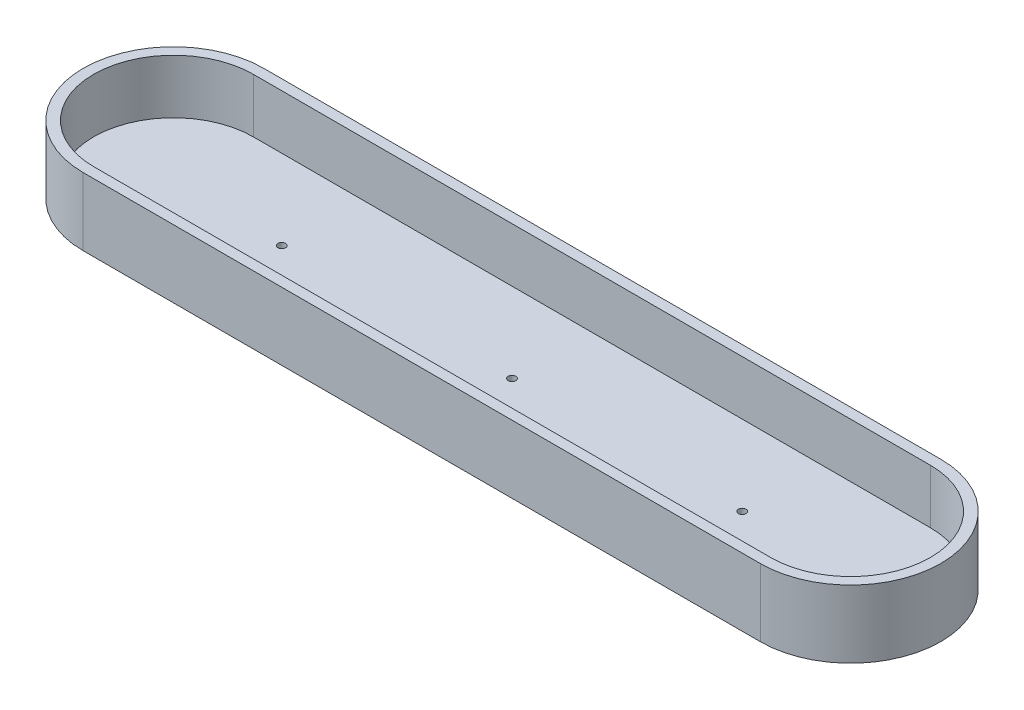
from build123d import *

# Parameters (mm, degrees)
MAINBLOCK_DEPTH     = 3.81
BOSS_EXTRUDE1_DEPTH = 19.05
SKETCH3_R           = 1.0795
CUT_EXTRUDE1_DEPTH  = 125.757705173


with BuildPart() as part:
    # Sketch1 → MainBlock (new body)
    with BuildSketch(Plane(origin=(0, 0, 0), x_dir=(1, 0, 0), z_dir=(0, 1, 0))):
        with BuildLine():
            Line((-95.25, 22.479), (95.25, 22.479))
            ThreePointArc((95.25, 22.479), (117.729, 0), (95.25, -22.479))
            Line((95.25, -22.479), (-95.25, -22.479))
            ThreePointArc((-95.25, -22.479), (-117.729, 0), (-95.25, 22.479))
        make_face()
    extrude(amount=MAINBLOCK_DEPTH)

    # Sketch2 → Boss-Extrude1 (add)
    with BuildSketch(Plane.XZ):
        with BuildLine():
            Line((-95.25, 25.4), (95.25, 25.4))
            ThreePointArc((95.25, 25.4), (120.65, 0), (95.25, -25.4))
            Line((95.25, -25.4), (-95.25, -25.4))
            ThreePointArc((-95.25, -25.4), (-120.65, 0), (-95.25, 25.4))
        make_face()
        with BuildLine():
            Line((95.25, 22.479), (-95.25, 22.479))
            ThreePointArc((-95.25, 22.479), (-117.729, 0), (-95.25, -22.479))
            Line((-95.25, -22.479), (95.25, -22.479))
            ThreePointArc((95.25, -22.479), (117.729, 0), (95.25, 22.479))
        make_face(mode=Mode.SUBTRACT)
    extrude(amount=-BOSS_EXTRUDE1_DEPTH)

    # Sketch3 → Cut-Extrude1 (cut, through all)
    with BuildSketch(Plane.XZ):
        with Locations(Location((0, 0, 0), (0, 0, 270))):
            Circle(SKETCH3_R)
        with Locations(Location((-64.77, 0, 0), (0, 0, 270))):
            Circle(SKETCH3_R)
        with Locations(Location((64.77, 0, 0), (0, 0, 270))):
            Circle(SKETCH3_R)
    extrude(amount=-CUT_EXTRUDE1_DEPTH, mode=Mode.SUBTRACT)


solid = part.part
